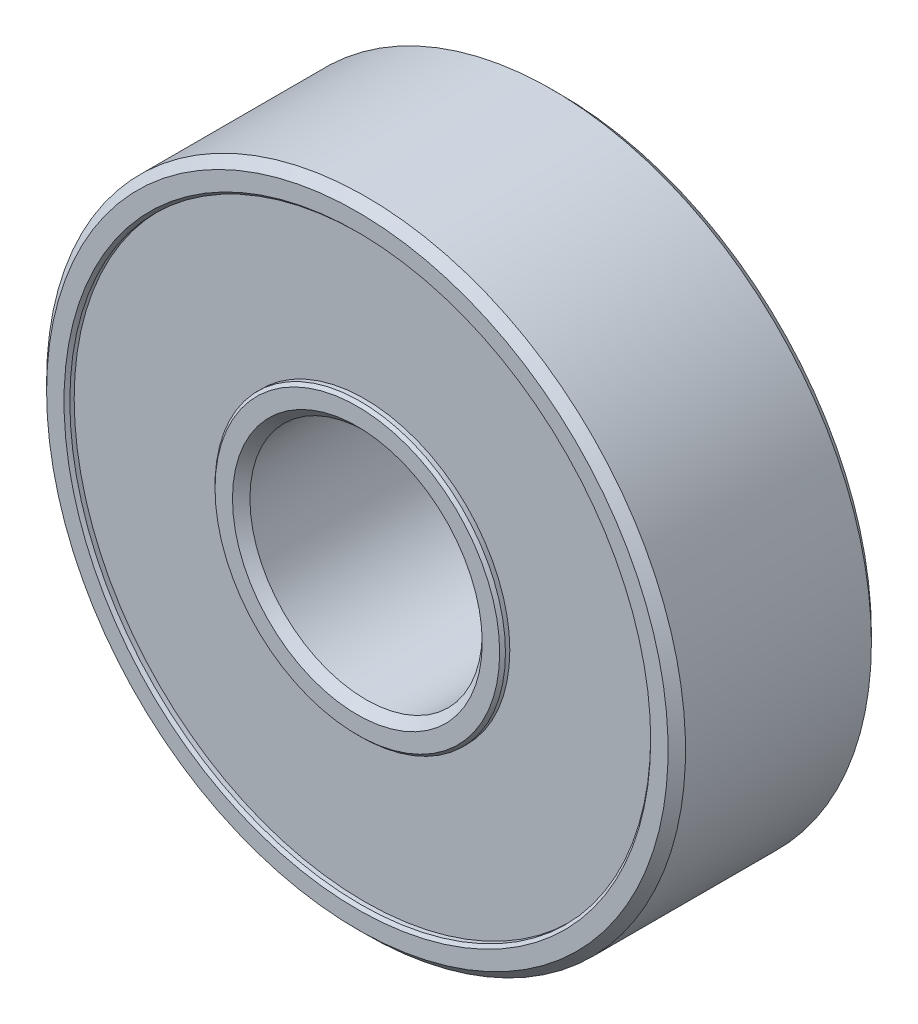
from build123d import *

# Parameters (mm, degrees)
SKETCH1_R             = 11
SKETCH1_R_2           = 10
BOSS_EXTRUDE1_DEPTH   = 3.5
SKETCH1_R_3           = 5
SKETCH1_R_4           = 4
BOSS_EXTRUDE1_2_DEPTH = 3.5
SKETCH1_3_R           = 10
SKETCH1_3_R_2         = 5
BOSS_EXTRUDE2_DEPTH   = 3.25
CHAMFER1_SIZE         = 0.3
CHAMFER2_SIZE         = 0.1


with BuildPart() as part:
    # Sketch1 → Boss-Extrude1 (new, symmetric)
    with BuildSketch(Plane.XY):
        Circle(SKETCH1_R)
        Circle(SKETCH1_R_2, mode=Mode.SUBTRACT)
    extrude(amount=BOSS_EXTRUDE1_DEPTH, both=True)



with BuildPart() as body_2:
    # Sketch1 → Boss-Extrude1 2 (new, symmetric)
    with BuildSketch(Plane.XY):
        Circle(SKETCH1_R_3)
        Circle(SKETCH1_R_4, mode=Mode.SUBTRACT)
    extrude(amount=BOSS_EXTRUDE1_2_DEPTH, both=True)


with BuildPart() as part_1:
    add(part.part)

    add(body_2.part)  # Boss-Extrude2 merges body 2
    # Sketch1<3> → Boss-Extrude2 (add, symmetric)
    with BuildSketch(Plane.XY):
        Circle(SKETCH1_3_R)
        Circle(SKETCH1_3_R_2, mode=Mode.SUBTRACT)
    extrude(amount=BOSS_EXTRUDE2_DEPTH, both=True)

    # Chamfer1
    chamfer1_edges = [part_1.edges().sort_by_distance(p)[0] for p in [
        (-4, 0, -3.5),
        (-11, 0, 3.5),
        (-11, 0, -3.5),
        (-4, 0, 3.5),
    ]]
    chamfer(chamfer1_edges, length=CHAMFER1_SIZE)

    # Chamfer2
    chamfer2_edges = [part_1.edges().sort_by_distance(p)[0] for p in [
        (-10, 0, 3.5),
        (-5, 0, 3.5),
        (-5, 0, -3.5),
        (-10, 0, -3.25),
    ]]
    chamfer(chamfer2_edges, length=CHAMFER2_SIZE)


solid = part_1.part
